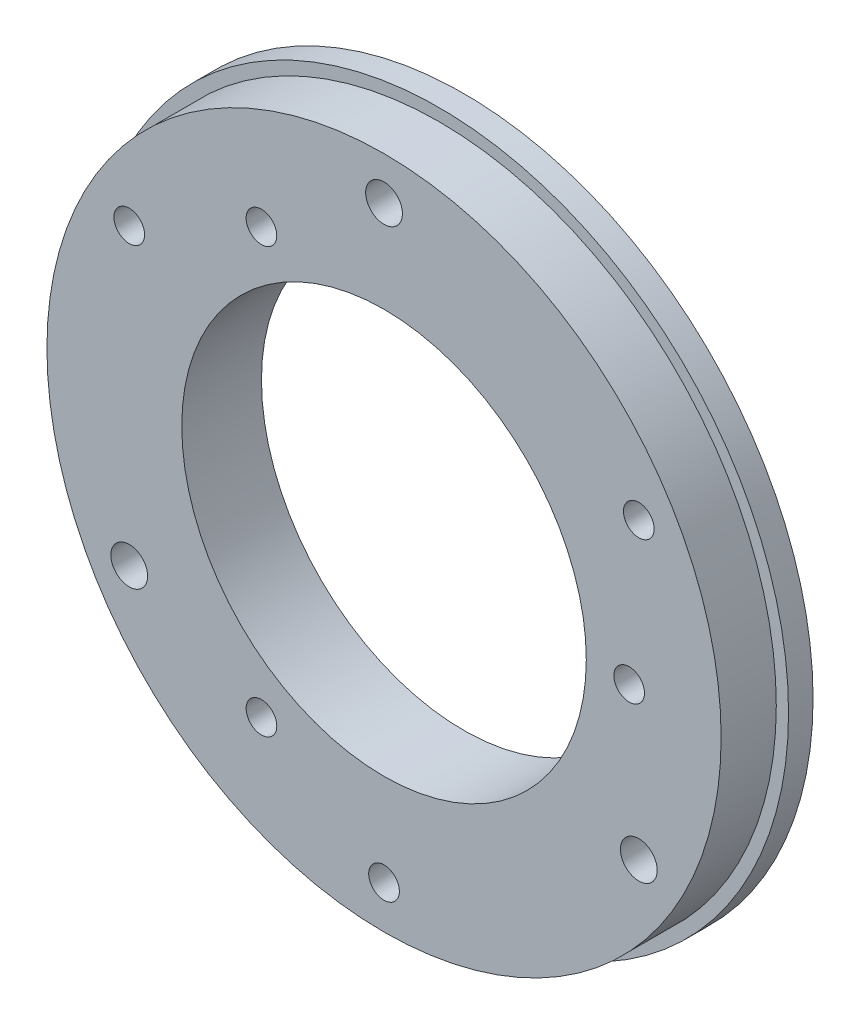
from build123d import *

# Parameters (mm, degrees)
SKETCH1_R           = 28.5
SKETCH1_R_2         = 19.5
BOSS_EXTRUDE1_DEPTH = 2
SKETCH2_R           = 27.5
SKETCH2_R_2         = 19.5
BOSS_EXTRUDE2_DEPTH = 4.5
SKETCH3_R           = 1.25
CUT_EXTRUDE1_DEPTH  = 41.825849654
CIRPATTERN1_COUNT   = 6
SKETCH5_R           = 19.5
SKETCH5_R_2         = 16.5
BOSS_EXTRUDE3_DEPTH = 6.5
SKETCH6_R           = 1.25
CUT_EXTRUDE2_DEPTH  = 10
CIRPATTERN2_COUNT   = 3
SKETCH8_R           = 3
CUT_EXTRUDE4_DEPTH  = 3.5
CIRPATTERN4_COUNT   = 3
SKETCH9_R           = 1.5
CUT_EXTRUDE5_DEPTH  = 41.456767048


with BuildPart() as part:
    # Sketch1 → Boss-Extrude1 (new body)
    with BuildSketch(Plane.XY):
        Circle(SKETCH1_R)
        Circle(SKETCH1_R_2, mode=Mode.SUBTRACT)
    extrude(amount=BOSS_EXTRUDE1_DEPTH)

    # Sketch2 → Boss-Extrude2 (add)
    with BuildSketch(Plane.XY.offset(2)):
        Circle(SKETCH2_R)
        Circle(SKETCH2_R_2, mode=Mode.SUBTRACT)
    extrude(amount=BOSS_EXTRUDE2_DEPTH)

    # Sketch3 → Cut-Extrude1 (cut, through all)
    with BuildSketch(Plane.XY.offset(6.5)):
        with Locations((0, 24)):
            Circle(SKETCH3_R)
    cut_extrude1 = extrude(amount=-CUT_EXTRUDE1_DEPTH, mode=Mode.SUBTRACT)

    # CirPattern1: Cut-Extrude1 ×6 about axis
    cirpattern1_axis = Axis((0, 0, 0), (0, 0, 1))
    for i in range(1, CIRPATTERN1_COUNT):
        add(cut_extrude1.rotate(cirpattern1_axis, i * 360 / CIRPATTERN1_COUNT), mode=Mode.SUBTRACT)

    # Sketch5 → Boss-Extrude3 (add)
    with BuildSketch(Plane(origin=(0, 0, 0), x_dir=(-1, 0, 0), z_dir=(0, 0, -1))):
        Circle(SKETCH5_R)
        Circle(SKETCH5_R_2, mode=Mode.SUBTRACT)
    extrude(amount=-BOSS_EXTRUDE3_DEPTH)

    # Sketch6 → Cut-Extrude2 (cut)
    with BuildSketch(Plane(origin=(0, 0, 0), x_dir=(-1, 0, 0), z_dir=(0, 0, -1))):
        with Locations((10, 17.320508076)):
            Circle(SKETCH6_R)
    cut_extrude2 = extrude(amount=-CUT_EXTRUDE2_DEPTH, mode=Mode.SUBTRACT)

    # CirPattern2: Cut-Extrude2 ×3 about axis
    cirpattern2_axis = Axis((0, 0, 0), (0, 0, 1))
    for i in range(1, CIRPATTERN2_COUNT):
        add(cut_extrude2.rotate(cirpattern2_axis, i * 360 / CIRPATTERN2_COUNT), mode=Mode.SUBTRACT)

    # Sketch8 → Cut-Extrude4 (cut)
    with BuildSketch(Plane(origin=(0, 0, 0), x_dir=(-1, 0, 0), z_dir=(0, 0, -1))):
        with Locations((0, 24)):
            Circle(SKETCH8_R)
    cut_extrude4 = extrude(amount=-CUT_EXTRUDE4_DEPTH, mode=Mode.SUBTRACT)

    # CirPattern4: Cut-Extrude4 ×3 about axis
    cirpattern4_axis = Axis((0, 0, 0), (0, 0, 1))
    for i in range(1, CIRPATTERN4_COUNT):
        add(cut_extrude4.rotate(cirpattern4_axis, i * 360 / CIRPATTERN4_COUNT), mode=Mode.SUBTRACT)

    # Sketch9 → Cut-Extrude5 (cut, through all)
    with BuildSketch(Plane(origin=(0, 0, 3.5), x_dir=(-1, 0, 0), z_dir=(0, 0, -1))):
        with Locations((0, 24)):
            Circle(SKETCH9_R)
        with Locations((20.784609691, -12)):
            Circle(SKETCH9_R)
        with Locations((-20.784609691, -12)):
            Circle(SKETCH9_R)
    extrude(amount=-CUT_EXTRUDE5_DEPTH, mode=Mode.SUBTRACT)


solid = part.part
